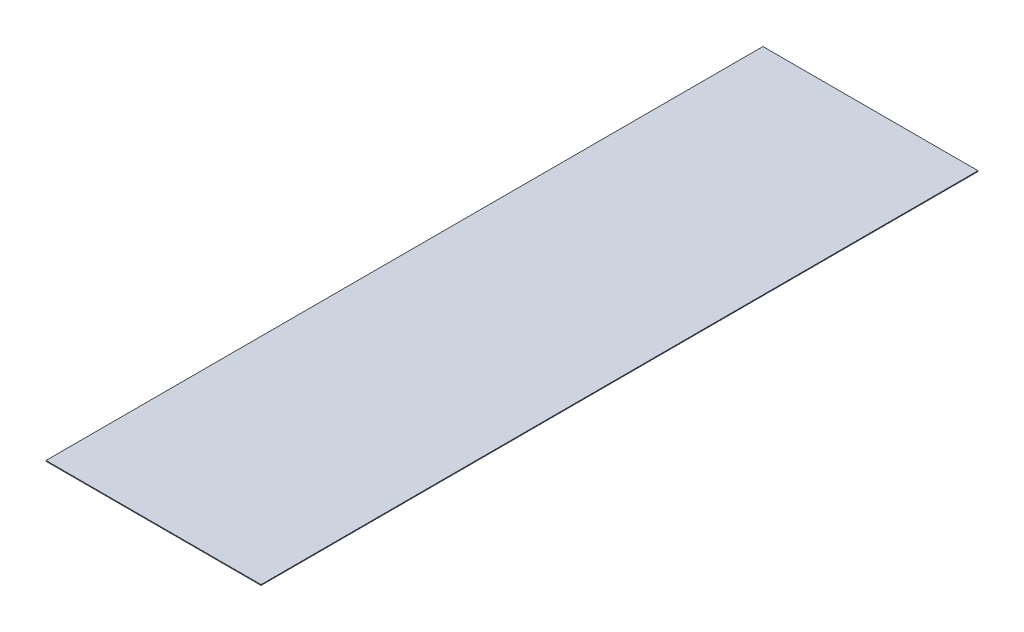
from build123d import *

# Parameters (mm, degrees)
CROQUIS1_W              = 914.4
CROQUIS1_H              = 3048
SALIENTE_EXTRUIR1_DEPTH = 3.2


with BuildPart() as part:
    # Croquis1 → Saliente-Extruir1 (new body)
    with BuildSketch(Plane(origin=(0, 0, 0), x_dir=(1, 0, 0), z_dir=(0, 1, 0))):
        Rectangle(CROQUIS1_W, CROQUIS1_H)
    extrude(amount=SALIENTE_EXTRUIR1_DEPTH)


solid = part.part
